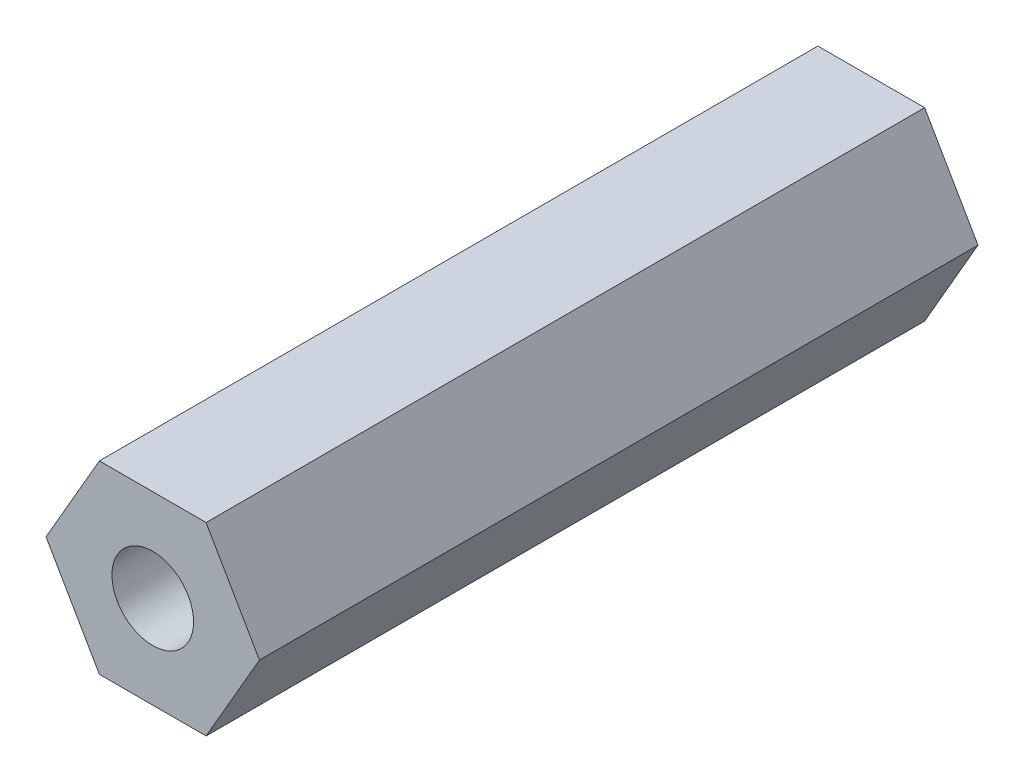
from build123d import *

# Parameters (mm, degrees)
EXTRUDE_329_DEPTH = 11


with BuildPart() as part:
    # 草图1 → Extrude 329 (new, symmetric)
    with BuildSketch(Plane.XY):
        Polygon((1.633901262, 2.83), (-1.633901262, 2.83), (-3.267802524, 0), (-1.633901262, -2.83), (1.633901262, -2.83), (3.267802524, 0), align=None)
    extrude(amount=EXTRUDE_329_DEPTH, both=True)

    # 草图3 → 螺纹孔1 (revolve, cut)
    with BuildSketch(Plane(origin=(0, 0, 11), x_dir=(0, -1, 0), z_dir=(1, 0, 0))):
        Polygon((0, 0), (0, 13.951075774), (1.25, 13.2), (1.25, 0), align=None)
    hole_wizard_1 = revolve(axis=Axis((0, 0, 17.35), (0, 0, -1)), mode=Mode.SUBTRACT)

    # 镜向1: 螺纹孔1 across plane
    add(hole_wizard_1.mirror(Plane.XY), mode=Mode.SUBTRACT)


solid = part.part
